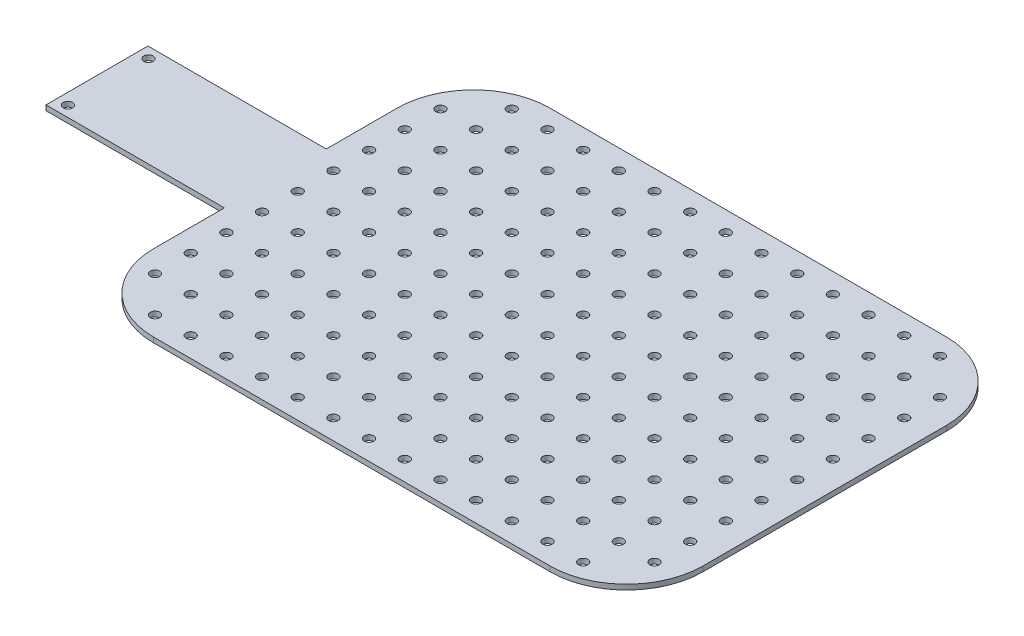
from build123d import *

# Parameters (mm, degrees)
SKETCH1_R           = 1.85
BOSS_EXTRUDE1_DEPTH = 2
SKETCH2_R           = 1.85
CUT_EXTRUDE1_DEPTH  = 2
SKETCH3_W           = 40
SKETCH3_H           = 2
CUT_EXTRUDE2_DEPTH  = 70


with BuildPart() as part:
    # Sketch1 → Boss-Extrude1 (new body)
    with BuildSketch(Plane(origin=(0, 0, 0), x_dir=(1, 0, 0), z_dir=(0, 1, 0))):
        with BuildLine():
            Line((77.8, 155.575), (-77.8, 155.575))
            ThreePointArc((-77.8, 155.575), (-99.013203436, 146.788203436), (-107.8, 125.575))
            Line((-107.8, 125.575), (-107.8, 97.7875))
            Line((-107.8, 97.7875), (-177.8, 97.7875))
            Line((-177.8, 97.7875), (-177.8, 57.7875))
            Line((-177.8, 57.7875), (-107.8, 57.7875))
            Line((-107.8, 57.7875), (-107.8, 30))
            ThreePointArc((-107.8, 30), (-99.013203436, 8.786796564), (-77.8, 0))
            Line((-77.8, 0), (77.8, 0))
            ThreePointArc((77.8, 0), (99.013203436, 8.786796564), (107.8, 30))
            Line((107.8, 30), (107.8, 57.7875))
            Line((107.8, 57.7875), (177.8, 57.7875))
            Line((177.8, 57.7875), (177.8, 97.7875))
            Line((177.8, 97.7875), (107.8, 97.7875))
            Line((107.8, 97.7875), (107.8, 125.575))
            ThreePointArc((107.8, 125.575), (99.013203436, 146.788203436), (77.8, 155.575))
        make_face()
        with Locations(Location((-173.4, 93.5875, 0), (0, 0, 270))):
            Circle(SKETCH1_R, mode=Mode.SUBTRACT)
        with Locations(Location((-173.4, 61.9875, 0), (0, 0, 270))):
            Circle(SKETCH1_R, mode=Mode.SUBTRACT)
        with Locations(Location((173.4, 61.9875, 0), (0, 0, 90))):
            Circle(SKETCH1_R, mode=Mode.SUBTRACT)
        with Locations(Location((173.4, 93.5875, 0), (0, 0, 90))):
            Circle(SKETCH1_R, mode=Mode.SUBTRACT)
    extrude(amount=BOSS_EXTRUDE1_DEPTH)

    # Sketch2 → Cut-Extrude1 (cut)
    with BuildSketch(Plane(origin=(0, 2, 0), x_dir=(1, 0, 0), z_dir=(0, 1, 0))):
        with Locations(Location((-99.013203436, 21.7875, 0), (0, 0, 270))):
            Circle(SKETCH2_R)
        with Locations(Location((-99.013203436, 35.7875, 0), (0, 0, 270))):
            Circle(SKETCH2_R)
        with Locations(Location((-99.013203436, 49.7875, 0), (0, 0, 270))):
            Circle(SKETCH2_R)
        with Locations(Location((-99.013203436, 63.7875, 0), (0, 0, 270))):
            Circle(SKETCH2_R)
        with Locations(Location((-99.013203436, 77.7875, 0), (0, 0, 270))):
            Circle(SKETCH2_R)
        with Locations(Location((-99.013203436, 91.7875, 0), (0, 0, 270))):
            Circle(SKETCH2_R)
        with Locations(Location((-99.013203436, 105.7875, 0), (0, 0, 270))):
            Circle(SKETCH2_R)
        with Locations(Location((-99.013203436, 119.7875, 0), (0, 0, 270))):
            Circle(SKETCH2_R)
        with Locations(Location((-99.013203436, 133.7875, 0), (0, 0, 270))):
            Circle(SKETCH2_R)
        with Locations(Location((-85.013203436, 63.7875, 0), (0, 0, 270))):
            Circle(SKETCH2_R)
        with Locations(Location((-85.013203436, 49.7875, 0), (0, 0, 270))):
            Circle(SKETCH2_R)
        with Locations(Location((-85.013203436, 35.7875, 0), (0, 0, 270))):
            Circle(SKETCH2_R)
        with Locations(Location((-85.013203436, 21.7875, 0), (0, 0, 270))):
            Circle(SKETCH2_R)
        with Locations(Location((-85.013203436, 91.7875, 0), (0, 0, 270))):
            Circle(SKETCH2_R)
        with Locations(Location((-85.013203436, 105.7875, 0), (0, 0, 270))):
            Circle(SKETCH2_R)
        with Locations(Location((-85.013203436, 77.7875, 0), (0, 0, 270))):
            Circle(SKETCH2_R)
        with Locations(Location((-85.013203436, 133.7875, 0), (0, 0, 270))):
            Circle(SKETCH2_R)
        with Locations(Location((-85.013203436, 119.7875, 0), (0, 0, 270))):
            Circle(SKETCH2_R)
        with Locations(Location((-71.013203436, 63.7875, 0), (0, 0, 270))):
            Circle(SKETCH2_R)
        with Locations(Location((-71.013203436, 49.7875, 0), (0, 0, 270))):
            Circle(SKETCH2_R)
        with Locations(Location((-71.013203436, 35.7875, 0), (0, 0, 270))):
            Circle(SKETCH2_R)
        with Locations(Location((-71.013203436, 21.7875, 0), (0, 0, 270))):
            Circle(SKETCH2_R)
        with Locations(Location((-71.013203436, 91.7875, 0), (0, 0, 270))):
            Circle(SKETCH2_R)
        with Locations(Location((-71.013203436, 105.7875, 0), (0, 0, 270))):
            Circle(SKETCH2_R)
        with Locations(Location((-71.013203436, 77.7875, 0), (0, 0, 270))):
            Circle(SKETCH2_R)
        with Locations(Location((-71.013203436, 133.7875, 0), (0, 0, 270))):
            Circle(SKETCH2_R)
        with Locations(Location((-71.013203436, 119.7875, 0), (0, 0, 270))):
            Circle(SKETCH2_R)
        with Locations(Location((-57.013203436, 63.7875, 0), (0, 0, 270))):
            Circle(SKETCH2_R)
        with Locations(Location((-57.013203436, 49.7875, 0), (0, 0, 270))):
            Circle(SKETCH2_R)
        with Locations(Location((-57.013203436, 35.7875, 0), (0, 0, 270))):
            Circle(SKETCH2_R)
        with Locations(Location((-57.013203436, 21.7875, 0), (0, 0, 270))):
            Circle(SKETCH2_R)
        with Locations(Location((-57.013203436, 91.7875, 0), (0, 0, 270))):
            Circle(SKETCH2_R)
        with Locations(Location((-57.013203436, 105.7875, 0), (0, 0, 270))):
            Circle(SKETCH2_R)
        with Locations(Location((-57.013203436, 77.7875, 0), (0, 0, 270))):
            Circle(SKETCH2_R)
        with Locations(Location((-57.013203436, 133.7875, 0), (0, 0, 270))):
            Circle(SKETCH2_R)
        with Locations(Location((-57.013203436, 119.7875, 0), (0, 0, 270))):
            Circle(SKETCH2_R)
        with Locations(Location((-43.013203436, 63.7875, 0), (0, 0, 270))):
            Circle(SKETCH2_R)
        with Locations(Location((-43.013203436, 49.7875, 0), (0, 0, 270))):
            Circle(SKETCH2_R)
        with Locations(Location((-43.013203436, 35.7875, 0), (0, 0, 270))):
            Circle(SKETCH2_R)
        with Locations(Location((-43.013203436, 21.7875, 0), (0, 0, 270))):
            Circle(SKETCH2_R)
        with Locations(Location((-43.013203436, 91.7875, 0), (0, 0, 270))):
            Circle(SKETCH2_R)
        with Locations(Location((-43.013203436, 105.7875, 0), (0, 0, 270))):
            Circle(SKETCH2_R)
        with Locations(Location((-43.013203436, 77.7875, 0), (0, 0, 270))):
            Circle(SKETCH2_R)
        with Locations(Location((-43.013203436, 133.7875, 0), (0, 0, 270))):
            Circle(SKETCH2_R)
        with Locations(Location((-43.013203436, 119.7875, 0), (0, 0, 270))):
            Circle(SKETCH2_R)
        with Locations(Location((-29.013203436, 63.7875, 0), (0, 0, 270))):
            Circle(SKETCH2_R)
        with Locations(Location((-29.013203436, 49.7875, 0), (0, 0, 270))):
            Circle(SKETCH2_R)
        with Locations(Location((-29.013203436, 35.7875, 0), (0, 0, 270))):
            Circle(SKETCH2_R)
        with Locations(Location((-29.013203436, 21.7875, 0), (0, 0, 270))):
            Circle(SKETCH2_R)
        with Locations(Location((-29.013203436, 91.7875, 0), (0, 0, 270))):
            Circle(SKETCH2_R)
        with Locations(Location((-29.013203436, 105.7875, 0), (0, 0, 270))):
            Circle(SKETCH2_R)
        with Locations(Location((-29.013203436, 77.7875, 0), (0, 0, 270))):
            Circle(SKETCH2_R)
        with Locations(Location((-29.013203436, 133.7875, 0), (0, 0, 270))):
            Circle(SKETCH2_R)
        with Locations(Location((-29.013203436, 119.7875, 0), (0, 0, 270))):
            Circle(SKETCH2_R)
        with Locations(Location((-15.013203436, 63.7875, 0), (0, 0, 270))):
            Circle(SKETCH2_R)
        with Locations(Location((-15.013203436, 49.7875, 0), (0, 0, 270))):
            Circle(SKETCH2_R)
        with Locations(Location((-15.013203436, 35.7875, 0), (0, 0, 270))):
            Circle(SKETCH2_R)
        with Locations(Location((-15.013203436, 21.7875, 0), (0, 0, 270))):
            Circle(SKETCH2_R)
        with Locations(Location((-15.013203436, 91.7875, 0), (0, 0, 270))):
            Circle(SKETCH2_R)
        with Locations(Location((-15.013203436, 105.7875, 0), (0, 0, 270))):
            Circle(SKETCH2_R)
        with Locations(Location((-15.013203436, 77.7875, 0), (0, 0, 270))):
            Circle(SKETCH2_R)
        with Locations(Location((-15.013203436, 133.7875, 0), (0, 0, 270))):
            Circle(SKETCH2_R)
        with Locations(Location((-15.013203436, 119.7875, 0), (0, 0, 270))):
            Circle(SKETCH2_R)
        with Locations(Location((-1.013203436, 63.7875, 0), (0, 0, 270))):
            Circle(SKETCH2_R)
        with Locations(Location((-1.013203436, 49.7875, 0), (0, 0, 270))):
            Circle(SKETCH2_R)
        with Locations(Location((-1.013203436, 35.7875, 0), (0, 0, 270))):
            Circle(SKETCH2_R)
        with Locations(Location((-1.013203436, 21.7875, 0), (0, 0, 270))):
            Circle(SKETCH2_R)
        with Locations(Location((-1.013203436, 91.7875, 0), (0, 0, 270))):
            Circle(SKETCH2_R)
        with Locations(Location((-1.013203436, 105.7875, 0), (0, 0, 270))):
            Circle(SKETCH2_R)
        with Locations(Location((-1.013203436, 77.7875, 0), (0, 0, 270))):
            Circle(SKETCH2_R)
        with Locations(Location((-1.013203436, 133.7875, 0), (0, 0, 270))):
            Circle(SKETCH2_R)
        with Locations(Location((-1.013203436, 119.7875, 0), (0, 0, 270))):
            Circle(SKETCH2_R)
        with Locations(Location((12.986796564, 63.7875, 0), (0, 0, 270))):
            Circle(SKETCH2_R)
        with Locations(Location((12.986796564, 49.7875, 0), (0, 0, 270))):
            Circle(SKETCH2_R)
        with Locations(Location((12.986796564, 35.7875, 0), (0, 0, 270))):
            Circle(SKETCH2_R)
        with Locations(Location((12.986796564, 21.7875, 0), (0, 0, 270))):
            Circle(SKETCH2_R)
        with Locations(Location((12.986796564, 91.7875, 0), (0, 0, 270))):
            Circle(SKETCH2_R)
        with Locations(Location((12.986796564, 105.7875, 0), (0, 0, 270))):
            Circle(SKETCH2_R)
        with Locations(Location((12.986796564, 77.7875, 0), (0, 0, 270))):
            Circle(SKETCH2_R)
        with Locations(Location((12.986796564, 133.7875, 0), (0, 0, 270))):
            Circle(SKETCH2_R)
        with Locations(Location((12.986796564, 119.7875, 0), (0, 0, 270))):
            Circle(SKETCH2_R)
        with Locations(Location((26.986796564, 63.7875, 0), (0, 0, 270))):
            Circle(SKETCH2_R)
        with Locations(Location((26.986796564, 49.7875, 0), (0, 0, 270))):
            Circle(SKETCH2_R)
        with Locations(Location((26.986796564, 35.7875, 0), (0, 0, 270))):
            Circle(SKETCH2_R)
        with Locations(Location((26.986796564, 21.7875, 0), (0, 0, 270))):
            Circle(SKETCH2_R)
        with Locations(Location((26.986796564, 91.7875, 0), (0, 0, 270))):
            Circle(SKETCH2_R)
        with Locations(Location((26.986796564, 105.7875, 0), (0, 0, 270))):
            Circle(SKETCH2_R)
        with Locations(Location((26.986796564, 77.7875, 0), (0, 0, 270))):
            Circle(SKETCH2_R)
        with Locations(Location((26.986796564, 133.7875, 0), (0, 0, 270))):
            Circle(SKETCH2_R)
        with Locations(Location((26.986796564, 119.7875, 0), (0, 0, 270))):
            Circle(SKETCH2_R)
        with Locations(Location((40.986796564, 63.7875, 0), (0, 0, 270))):
            Circle(SKETCH2_R)
        with Locations(Location((40.986796564, 49.7875, 0), (0, 0, 270))):
            Circle(SKETCH2_R)
        with Locations(Location((40.986796564, 35.7875, 0), (0, 0, 270))):
            Circle(SKETCH2_R)
        with Locations(Location((40.986796564, 21.7875, 0), (0, 0, 270))):
            Circle(SKETCH2_R)
        with Locations(Location((40.986796564, 91.7875, 0), (0, 0, 270))):
            Circle(SKETCH2_R)
        with Locations(Location((40.986796564, 105.7875, 0), (0, 0, 270))):
            Circle(SKETCH2_R)
        with Locations(Location((40.986796564, 77.7875, 0), (0, 0, 270))):
            Circle(SKETCH2_R)
        with Locations(Location((40.986796564, 133.7875, 0), (0, 0, 270))):
            Circle(SKETCH2_R)
        with Locations(Location((40.986796564, 119.7875, 0), (0, 0, 270))):
            Circle(SKETCH2_R)
        with Locations(Location((54.986796564, 63.7875, 0), (0, 0, 270))):
            Circle(SKETCH2_R)
        with Locations(Location((54.986796564, 49.7875, 0), (0, 0, 270))):
            Circle(SKETCH2_R)
        with Locations(Location((54.986796564, 35.7875, 0), (0, 0, 270))):
            Circle(SKETCH2_R)
        with Locations(Location((54.986796564, 21.7875, 0), (0, 0, 270))):
            Circle(SKETCH2_R)
        with Locations(Location((54.986796564, 91.7875, 0), (0, 0, 270))):
            Circle(SKETCH2_R)
        with Locations(Location((54.986796564, 105.7875, 0), (0, 0, 270))):
            Circle(SKETCH2_R)
        with Locations(Location((54.986796564, 77.7875, 0), (0, 0, 270))):
            Circle(SKETCH2_R)
        with Locations(Location((54.986796564, 133.7875, 0), (0, 0, 270))):
            Circle(SKETCH2_R)
        with Locations(Location((54.986796564, 119.7875, 0), (0, 0, 270))):
            Circle(SKETCH2_R)
        with Locations(Location((68.986796564, 63.7875, 0), (0, 0, 270))):
            Circle(SKETCH2_R)
        with Locations(Location((68.986796564, 49.7875, 0), (0, 0, 270))):
            Circle(SKETCH2_R)
        with Locations(Location((68.986796564, 35.7875, 0), (0, 0, 270))):
            Circle(SKETCH2_R)
        with Locations(Location((68.986796564, 21.7875, 0), (0, 0, 270))):
            Circle(SKETCH2_R)
        with Locations(Location((68.986796564, 91.7875, 0), (0, 0, 270))):
            Circle(SKETCH2_R)
        with Locations(Location((68.986796564, 105.7875, 0), (0, 0, 270))):
            Circle(SKETCH2_R)
        with Locations(Location((68.986796564, 77.7875, 0), (0, 0, 270))):
            Circle(SKETCH2_R)
        with Locations(Location((68.986796564, 133.7875, 0), (0, 0, 270))):
            Circle(SKETCH2_R)
        with Locations(Location((68.986796564, 119.7875, 0), (0, 0, 270))):
            Circle(SKETCH2_R)
        with Locations(Location((82.986796564, 63.7875, 0), (0, 0, 270))):
            Circle(SKETCH2_R)
        with Locations(Location((82.986796564, 49.7875, 0), (0, 0, 270))):
            Circle(SKETCH2_R)
        with Locations(Location((82.986796564, 35.7875, 0), (0, 0, 270))):
            Circle(SKETCH2_R)
        with Locations(Location((82.986796564, 21.7875, 0), (0, 0, 270))):
            Circle(SKETCH2_R)
        with Locations(Location((82.986796564, 91.7875, 0), (0, 0, 270))):
            Circle(SKETCH2_R)
        with Locations(Location((82.986796564, 105.7875, 0), (0, 0, 270))):
            Circle(SKETCH2_R)
        with Locations(Location((82.986796564, 77.7875, 0), (0, 0, 270))):
            Circle(SKETCH2_R)
        with Locations(Location((82.986796564, 133.7875, 0), (0, 0, 270))):
            Circle(SKETCH2_R)
        with Locations(Location((82.986796564, 119.7875, 0), (0, 0, 270))):
            Circle(SKETCH2_R)
        with Locations(Location((96.986796564, 63.7875, 0), (0, 0, 270))):
            Circle(SKETCH2_R)
        with Locations(Location((96.986796564, 49.7875, 0), (0, 0, 270))):
            Circle(SKETCH2_R)
        with Locations(Location((96.986796564, 35.7875, 0), (0, 0, 270))):
            Circle(SKETCH2_R)
        with Locations(Location((96.986796564, 21.7875, 0), (0, 0, 270))):
            Circle(SKETCH2_R)
        with Locations(Location((96.986796564, 91.7875, 0), (0, 0, 270))):
            Circle(SKETCH2_R)
        with Locations(Location((96.986796564, 105.7875, 0), (0, 0, 270))):
            Circle(SKETCH2_R)
        with Locations(Location((96.986796564, 77.7875, 0), (0, 0, 270))):
            Circle(SKETCH2_R)
        with Locations(Location((96.986796564, 133.7875, 0), (0, 0, 270))):
            Circle(SKETCH2_R)
        with Locations(Location((96.986796564, 119.7875, 0), (0, 0, 270))):
            Circle(SKETCH2_R)
        with Locations(Location((-85.013203436, 147.7875, 0), (0, 0, 270))):
            Circle(SKETCH2_R)
        with Locations(Location((-1.013203436, 147.7875, 0), (0, 0, 270))):
            Circle(SKETCH2_R)
        with Locations(Location((-15.013203436, 147.7875, 0), (0, 0, 270))):
            Circle(SKETCH2_R)
        with Locations(Location((-29.013203436, 147.7875, 0), (0, 0, 270))):
            Circle(SKETCH2_R)
        with Locations(Location((-43.013203436, 147.7875, 0), (0, 0, 270))):
            Circle(SKETCH2_R)
        with Locations(Location((-57.013203436, 147.7875, 0), (0, 0, 270))):
            Circle(SKETCH2_R)
        with Locations(Location((-71.013203436, 147.7875, 0), (0, 0, 270))):
            Circle(SKETCH2_R)
        with Locations(Location((12.986796564, 147.7875, 0), (0, 0, 270))):
            Circle(SKETCH2_R)
        with Locations(Location((26.986796564, 147.7875, 0), (0, 0, 270))):
            Circle(SKETCH2_R)
        with Locations(Location((82.986796564, 147.7875, 0), (0, 0, 270))):
            Circle(SKETCH2_R)
        with Locations(Location((68.986796564, 147.7875, 0), (0, 0, 270))):
            Circle(SKETCH2_R)
        with Locations(Location((54.986796564, 147.7875, 0), (0, 0, 270))):
            Circle(SKETCH2_R)
        with Locations(Location((40.986796564, 147.7875, 0), (0, 0, 270))):
            Circle(SKETCH2_R)
        with Locations(Location((-85.013203436, 7.7875, 0), (0, 0, 270))):
            Circle(SKETCH2_R)
        with Locations(Location((-71.013203436, 7.7875, 0), (0, 0, 270))):
            Circle(SKETCH2_R)
        with Locations(Location((-57.013203436, 7.7875, 0), (0, 0, 270))):
            Circle(SKETCH2_R)
        with Locations(Location((-43.013203436, 7.7875, 0), (0, 0, 270))):
            Circle(SKETCH2_R)
        with Locations(Location((-29.013203436, 7.7875, 0), (0, 0, 270))):
            Circle(SKETCH2_R)
        with Locations(Location((-15.013203436, 7.7875, 0), (0, 0, 270))):
            Circle(SKETCH2_R)
        with Locations(Location((-1.013203436, 7.7875, 0), (0, 0, 270))):
            Circle(SKETCH2_R)
        with Locations(Location((12.986796564, 7.7875, 0), (0, 0, 270))):
            Circle(SKETCH2_R)
        with Locations(Location((26.986796564, 7.7875, 0), (0, 0, 270))):
            Circle(SKETCH2_R)
        with Locations(Location((40.986796564, 7.7875, 0), (0, 0, 270))):
            Circle(SKETCH2_R)
        with Locations(Location((54.986796564, 7.7875, 0), (0, 0, 270))):
            Circle(SKETCH2_R)
        with Locations(Location((68.986796564, 7.7875, 0), (0, 0, 270))):
            Circle(SKETCH2_R)
        with Locations(Location((82.986796564, 7.7875, 0), (0, 0, 270))):
            Circle(SKETCH2_R)
    extrude(amount=-CUT_EXTRUDE1_DEPTH, mode=Mode.SUBTRACT)

    # Sketch3 → Cut-Extrude2 (cut)
    with BuildSketch(Plane(origin=(177.8, 0, 0), x_dir=(0, 0, -1), z_dir=(1, 0, 0))):
        with Locations((77.7875, 1)):
            Rectangle(SKETCH3_W, SKETCH3_H)
    extrude(amount=-CUT_EXTRUDE2_DEPTH, mode=Mode.SUBTRACT)


solid = part.part
